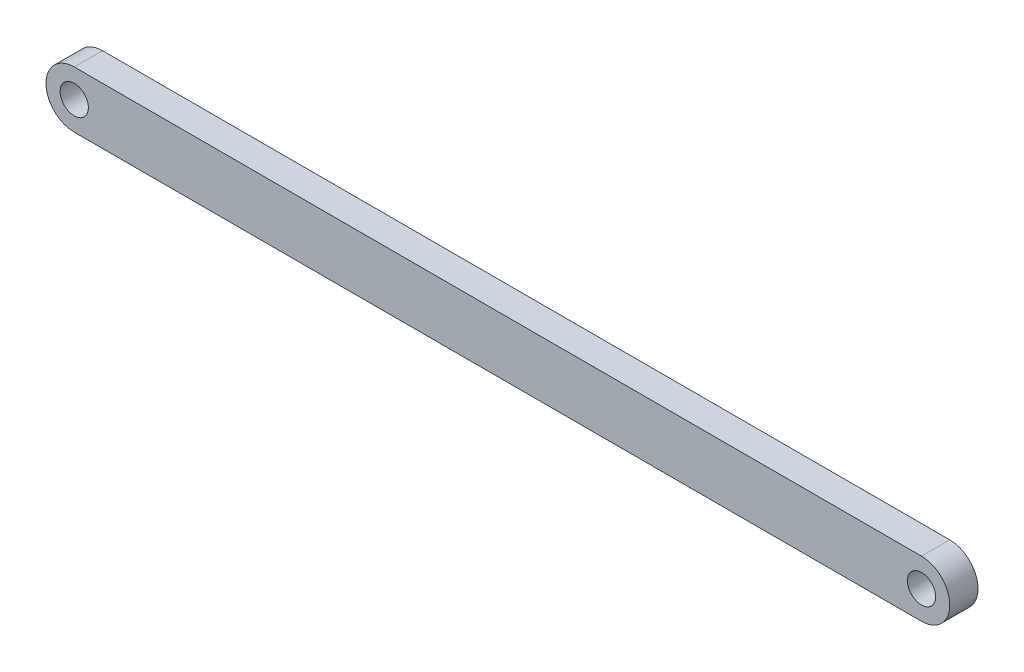
from build123d import *

# Parameters (mm, degrees)
EXTRUDE_1_DEPTH = 10


with BuildPart() as part:
    # ｽｹｯﾁ1 → ﾎﾞｽ - 押し出し1 (new body)
    with BuildSketch(Plane.XY):
        with BuildLine():
            ThreePointArc((-150, 10), (-160, 0), (-150, -10))
            Line((-150, -10), (-150, -5))
            ThreePointArc((-150, -5), (-155, 0), (-150, 5))
            Line((-150, 5), (-150, 10))
        make_face()
        with BuildLine():
            Line((-150, -5), (-150, -10))
            ThreePointArc((-150, -10), (-142.928932188, -7.071067812), (-140, 0))
            ThreePointArc((-140, 0), (-142.928932188, 7.071067812), (-150, 10))
            Line((-150, 10), (-150, 5))
            ThreePointArc((-150, 5), (-146.464466094, 3.535533906), (-145, 0))
            ThreePointArc((-145, 0), (-146.464466094, -3.535533906), (-150, -5))
        make_face()
        with BuildLine():
            ThreePointArc((-140, 0), (-142.928932188, -7.071067812), (-150, -10))
            Line((-150, -10), (150, -10))
            ThreePointArc((150, -10), (140, 0), (150, 10))
            Line((150, 10), (-150, 10))
            ThreePointArc((-150, 10), (-142.928932188, 7.071067812), (-140, 0))
        make_face()
        with BuildLine():
            ThreePointArc((150, 10), (140, 0), (150, -10))
            Line((150, -10), (150, -5))
            ThreePointArc((150, -5), (145, 0), (150, 5))
            Line((150, 5), (150, 10))
        make_face()
        with BuildLine():
            Line((150, -5), (150, -10))
            ThreePointArc((150, -10), (157.071067812, -7.071067812), (160, 0))
            ThreePointArc((160, 0), (157.071067812, 7.071067812), (150, 10))
            Line((150, 10), (150, 5))
            ThreePointArc((150, 5), (153.535533906, 3.535533906), (155, 0))
            ThreePointArc((155, 0), (153.535533906, -3.535533906), (150, -5))
        make_face()
    extrude(amount=EXTRUDE_1_DEPTH)


solid = part.part
